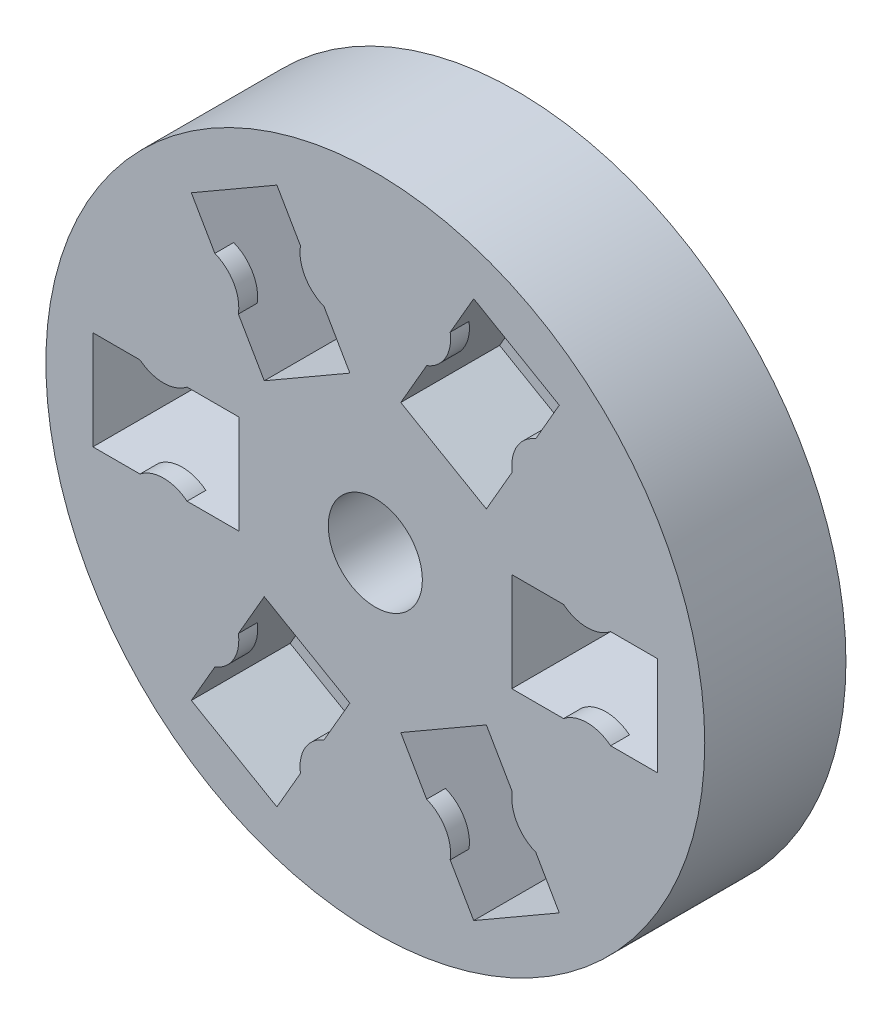
from build123d import *

# Parameters (mm, degrees)
SKETCH1_R           = 7
SKETCH1_R_2         = 1
BOSS_EXTRUDE1_DEPTH = 3
SKETCH2_W           = 3.1
SKETCH2_H           = 2.1
CUT_EXTRUDE1_DEPTH  = 2.1
CIRPATTERN1_COUNT   = 6
BOSS_EXTRUDE2_DEPTH = 0.4
CIRPATTERN2_COUNT   = 6


with BuildPart() as part:
    # Sketch1 → Boss-Extrude1 (new body)
    with BuildSketch(Plane.XY):
        with Locations((-9.5, 0)):
            Circle(SKETCH1_R)
        with Locations((-9.5, 0)):
            Circle(SKETCH1_R_2, mode=Mode.SUBTRACT)
    extrude(amount=-BOSS_EXTRUDE1_DEPTH)

    # Sketch2 → Cut-Extrude1 (cut)
    with BuildSketch(Plane.XY):
        with Locations((-13.95, 0)):
            Rectangle(SKETCH2_W, SKETCH2_H)
    cut_extrude1 = extrude(amount=-CUT_EXTRUDE1_DEPTH, mode=Mode.SUBTRACT)

    # CirPattern1: Cut-Extrude1 ×6 about axis
    cirpattern1_axis = Axis((-9.5, 0, 0), (0, 0, 1))
    for i in range(1, CIRPATTERN1_COUNT):
        add(cut_extrude1.rotate(cirpattern1_axis, i * 360 / CIRPATTERN1_COUNT), mode=Mode.SUBTRACT)

    # Sketch3 → Boss-Extrude2 (add)
    with BuildSketch(Plane.XY):
        with BuildLine():
            Line((-14.5, -1.05), (-13.5, -1.05))
            ThreePointArc((-13.5, -1.05), (-14, -0.8744998), (-14.5, -1.05))
        make_face()
        with BuildLine():
            Line((-14.5, 1.05), (-13.5, 1.05))
            ThreePointArc((-13.5, 1.05), (-14, 0.8744998), (-14.5, 1.05))
        make_face()
    boss_extrude2 = extrude(amount=-BOSS_EXTRUDE2_DEPTH)

    # CirPattern2: Boss-Extrude2 ×6 about axis
    cirpattern2_axis = Axis((-9.5, 0, 0), (0, 0, 1))
    for i in range(1, CIRPATTERN2_COUNT):
        add(boss_extrude2.rotate(cirpattern2_axis, i * 360 / CIRPATTERN2_COUNT))


solid = part.part
